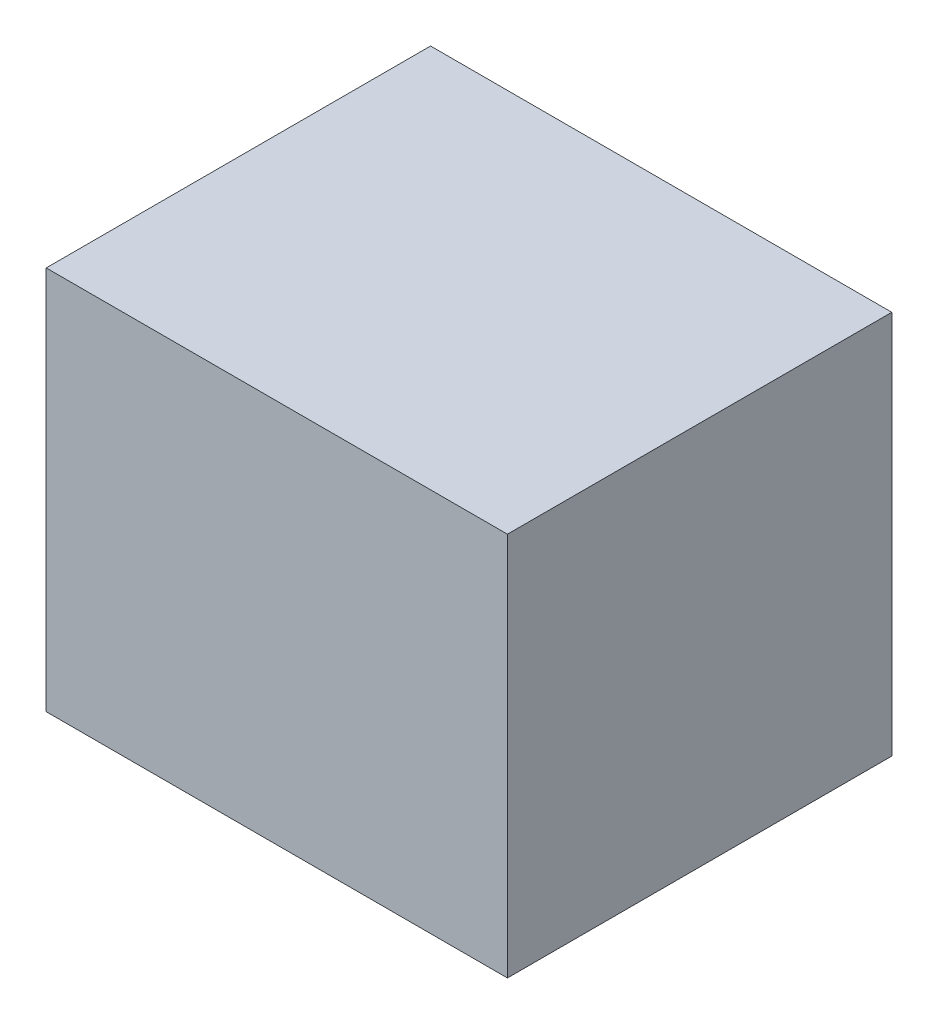
from build123d import *

# Parameters (mm, degrees)
SKETCH1_W           = 600
SKETCH1_H           = 500
BOSS_EXTRUDE1_DEPTH = 500
SHELL1_T            = 35


with BuildPart() as part:
    # Sketch1 → Boss-Extrude1 (new body)
    with BuildSketch(Plane.XY):
        with Locations((300, 250)):
            Rectangle(SKETCH1_W, SKETCH1_H)
    extrude(amount=BOSS_EXTRUDE1_DEPTH)

    # Shell1 (no face opened: a closed hollow body)
    add(offset(amount=-SHELL1_T, mode=Mode.PRIVATE), mode=Mode.SUBTRACT)


solid = part.part
